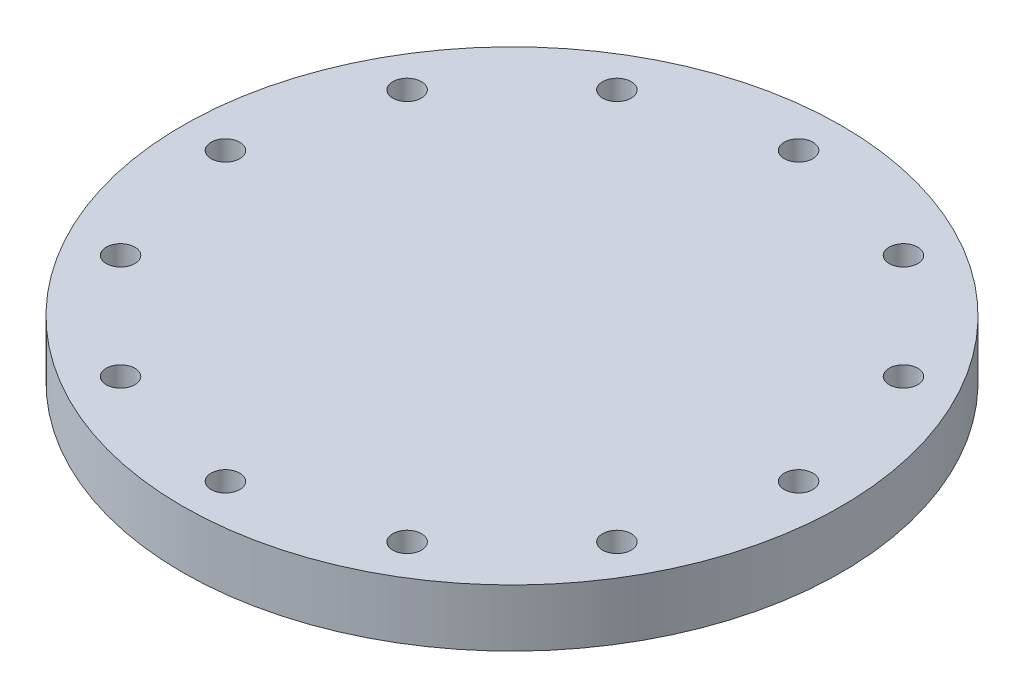
from build123d import *

# Parameters (mm, degrees)
SKETCH1_R           = 115
BOSS_EXTRUDE1_DEPTH = 20
CUT_EXTRUDE1_REACH  = 165.86
SKETCH2_R           = 5


with BuildPart() as part:
    # Sketch1 → Boss-Extrude1 (new body)
    with BuildSketch(Plane(origin=(0, 0, 0), x_dir=(1, 0, 0), z_dir=(0, 1, 0))):
        with Locations(Location((0, 0, 0), (0, 0, 270))):
            Circle(SKETCH1_R)
    extrude(amount=BOSS_EXTRUDE1_DEPTH)

    # Sketch2 → Cut-Extrude1 (cut, up to next)
    with BuildSketch(Plane(origin=(0, 20, 0), x_dir=(1, 0, 0), z_dir=(0, 1, 0)), mode=Mode.PRIVATE) as cut_extrude1_sk1:
        with Locations(Location((0, 100, 0), (0, 0, 270))):
            Circle(SKETCH2_R)
    cut_extrude1_tool1 = extrude(cut_extrude1_sk1.sketch, amount=-CUT_EXTRUDE1_REACH, mode=Mode.PRIVATE) & part.part
    # Sketch2 → Cut-Extrude1 (cut, up to next)
    with BuildSketch(Plane(origin=(0, 20, 0), x_dir=(1, 0, 0), z_dir=(0, 1, 0)), mode=Mode.PRIVATE) as cut_extrude1_sk2:
        with Locations(Location((50, 86.602540378, 0), (0, 0, 270))):
            Circle(SKETCH2_R)
    cut_extrude1_tool2 = extrude(cut_extrude1_sk2.sketch, amount=-CUT_EXTRUDE1_REACH, mode=Mode.PRIVATE) & part.part
    # Sketch2 → Cut-Extrude1 (cut, up to next)
    with BuildSketch(Plane(origin=(0, 20, 0), x_dir=(1, 0, 0), z_dir=(0, 1, 0)), mode=Mode.PRIVATE) as cut_extrude1_sk3:
        with Locations(Location((86.602540378, 50, 0), (0, 0, 270))):
            Circle(SKETCH2_R)
    cut_extrude1_tool3 = extrude(cut_extrude1_sk3.sketch, amount=-CUT_EXTRUDE1_REACH, mode=Mode.PRIVATE) & part.part
    # Sketch2 → Cut-Extrude1 (cut, up to next)
    with BuildSketch(Plane(origin=(0, 20, 0), x_dir=(1, 0, 0), z_dir=(0, 1, 0)), mode=Mode.PRIVATE) as cut_extrude1_sk4:
        with Locations(Location((100, 0, 0), (0, 0, 270))):
            Circle(SKETCH2_R)
    cut_extrude1_tool4 = extrude(cut_extrude1_sk4.sketch, amount=-CUT_EXTRUDE1_REACH, mode=Mode.PRIVATE) & part.part
    # Sketch2 → Cut-Extrude1 (cut, up to next)
    with BuildSketch(Plane(origin=(0, 20, 0), x_dir=(1, 0, 0), z_dir=(0, 1, 0)), mode=Mode.PRIVATE) as cut_extrude1_sk5:
        with Locations(Location((86.602540378, -50, 0), (0, 0, 270))):
            Circle(SKETCH2_R)
    cut_extrude1_tool5 = extrude(cut_extrude1_sk5.sketch, amount=-CUT_EXTRUDE1_REACH, mode=Mode.PRIVATE) & part.part
    # Sketch2 → Cut-Extrude1 (cut, up to next)
    with BuildSketch(Plane(origin=(0, 20, 0), x_dir=(1, 0, 0), z_dir=(0, 1, 0)), mode=Mode.PRIVATE) as cut_extrude1_sk6:
        with Locations(Location((50, -86.602540378, 0), (0, 0, 270))):
            Circle(SKETCH2_R)
    cut_extrude1_tool6 = extrude(cut_extrude1_sk6.sketch, amount=-CUT_EXTRUDE1_REACH, mode=Mode.PRIVATE) & part.part
    # Sketch2 → Cut-Extrude1 (cut, up to next)
    with BuildSketch(Plane(origin=(0, 20, 0), x_dir=(1, 0, 0), z_dir=(0, 1, 0)), mode=Mode.PRIVATE) as cut_extrude1_sk7:
        with Locations(Location((0, -100, 0), (0, 0, 270))):
            Circle(SKETCH2_R)
    cut_extrude1_tool7 = extrude(cut_extrude1_sk7.sketch, amount=-CUT_EXTRUDE1_REACH, mode=Mode.PRIVATE) & part.part
    # Sketch2 → Cut-Extrude1 (cut, up to next)
    with BuildSketch(Plane(origin=(0, 20, 0), x_dir=(1, 0, 0), z_dir=(0, 1, 0)), mode=Mode.PRIVATE) as cut_extrude1_sk8:
        with Locations(Location((-50, -86.602540378, 0), (0, 0, 270))):
            Circle(SKETCH2_R)
    cut_extrude1_tool8 = extrude(cut_extrude1_sk8.sketch, amount=-CUT_EXTRUDE1_REACH, mode=Mode.PRIVATE) & part.part
    # Sketch2 → Cut-Extrude1 (cut, up to next)
    with BuildSketch(Plane(origin=(0, 20, 0), x_dir=(1, 0, 0), z_dir=(0, 1, 0)), mode=Mode.PRIVATE) as cut_extrude1_sk9:
        with Locations(Location((-86.602540378, -50, 0), (0, 0, 270))):
            Circle(SKETCH2_R)
    cut_extrude1_tool9 = extrude(cut_extrude1_sk9.sketch, amount=-CUT_EXTRUDE1_REACH, mode=Mode.PRIVATE) & part.part
    # Sketch2 → Cut-Extrude1 (cut, up to next)
    with BuildSketch(Plane(origin=(0, 20, 0), x_dir=(1, 0, 0), z_dir=(0, 1, 0)), mode=Mode.PRIVATE) as cut_extrude1_sk10:
        with Locations(Location((-100, 0, 0), (0, 0, 270))):
            Circle(SKETCH2_R)
    cut_extrude1_tool10 = extrude(cut_extrude1_sk10.sketch, amount=-CUT_EXTRUDE1_REACH, mode=Mode.PRIVATE) & part.part
    # Sketch2 → Cut-Extrude1 (cut, up to next)
    with BuildSketch(Plane(origin=(0, 20, 0), x_dir=(1, 0, 0), z_dir=(0, 1, 0)), mode=Mode.PRIVATE) as cut_extrude1_sk11:
        with Locations(Location((-86.602540378, 50, 0), (0, 0, 270))):
            Circle(SKETCH2_R)
    cut_extrude1_tool11 = extrude(cut_extrude1_sk11.sketch, amount=-CUT_EXTRUDE1_REACH, mode=Mode.PRIVATE) & part.part
    # Sketch2 → Cut-Extrude1 (cut, up to next)
    with BuildSketch(Plane(origin=(0, 20, 0), x_dir=(1, 0, 0), z_dir=(0, 1, 0)), mode=Mode.PRIVATE) as cut_extrude1_sk12:
        with Locations(Location((-50, 86.602540378, 0), (0, 0, 270))):
            Circle(SKETCH2_R)
    cut_extrude1_tool12 = extrude(cut_extrude1_sk12.sketch, amount=-CUT_EXTRUDE1_REACH, mode=Mode.PRIVATE) & part.part
    add(cut_extrude1_tool1.solids().sort_by_distance((0, 20, -100))[0], mode=Mode.SUBTRACT)
    add(cut_extrude1_tool2.solids().sort_by_distance((50, 20, -86.60254))[0], mode=Mode.SUBTRACT)
    add(cut_extrude1_tool3.solids().sort_by_distance((86.60254, 20, -50))[0], mode=Mode.SUBTRACT)
    add(cut_extrude1_tool4.solids().sort_by_distance((100, 20, 0))[0], mode=Mode.SUBTRACT)
    add(cut_extrude1_tool5.solids().sort_by_distance((86.60254, 20, 50))[0], mode=Mode.SUBTRACT)
    add(cut_extrude1_tool6.solids().sort_by_distance((50, 20, 86.60254))[0], mode=Mode.SUBTRACT)
    add(cut_extrude1_tool7.solids().sort_by_distance((0, 20, 100))[0], mode=Mode.SUBTRACT)
    add(cut_extrude1_tool8.solids().sort_by_distance((-50, 20, 86.60254))[0], mode=Mode.SUBTRACT)
    add(cut_extrude1_tool9.solids().sort_by_distance((-86.60254, 20, 50))[0], mode=Mode.SUBTRACT)
    add(cut_extrude1_tool10.solids().sort_by_distance((-100, 20, 0))[0], mode=Mode.SUBTRACT)
    add(cut_extrude1_tool11.solids().sort_by_distance((-86.60254, 20, -50))[0], mode=Mode.SUBTRACT)
    add(cut_extrude1_tool12.solids().sort_by_distance((-50, 20, -86.60254))[0], mode=Mode.SUBTRACT)


solid = part.part
